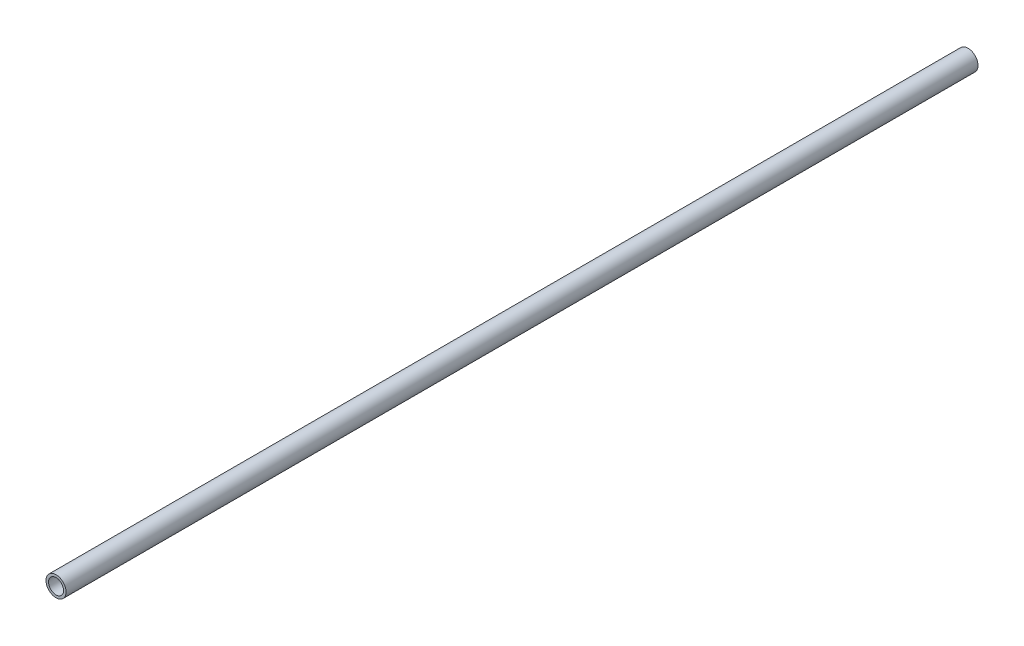
from build123d import *

# Parameters (mm, degrees)
SKETCH1_R           = 9.525
SKETCH1_R_2         = 7.14375
BOSS_EXTRUDE1_DEPTH = 865.378


with BuildPart() as part:
    # Sketch1 → Boss-Extrude1 (new body)
    with BuildSketch(Plane.XY):
        Circle(SKETCH1_R)
        Circle(SKETCH1_R_2, mode=Mode.SUBTRACT)
    extrude(amount=BOSS_EXTRUDE1_DEPTH)


solid = part.part
